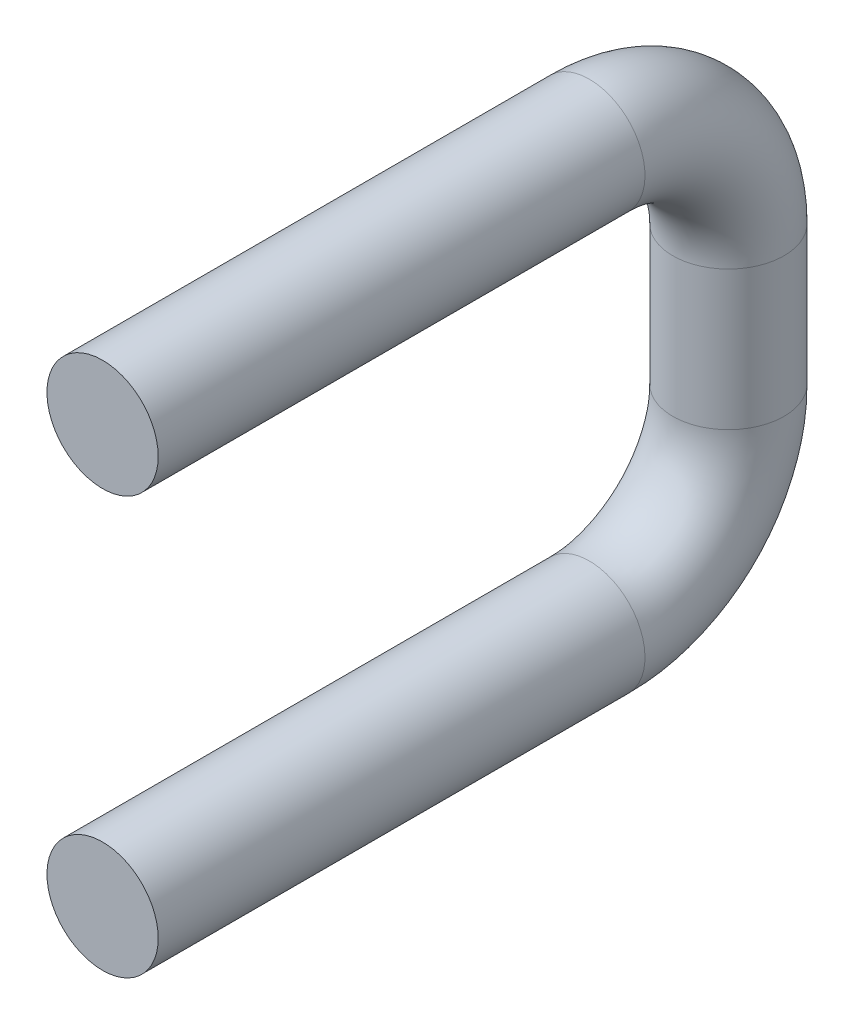
from build123d import *

# Parameters (mm, degrees)
SKETCH_2_R = 4


with BuildPart() as part:
    # По траектории1: sweep along a path in Эскиз1
    with BuildLine(Plane(origin=(0, 0, 0), x_dir=(0, 0, -1), z_dir=(1, 0, 0))) as sweep_1_path:
        Line((0, -15), (35, -15))
        ThreePointArc((35, -15), (42.071067812, -12.071067812), (45, -5))
        Line((45, -5), (45, 5))
        ThreePointArc((45, 5), (42.071067812, 12.071067812), (35, 15))
        Line((35, 15), (0, 15))
    # Эскиз2 → По траектории1 (sweep)
    with BuildSketch(Plane.XY):
        with Locations((0, -15)):
            Circle(SKETCH_2_R)
    sweep(path=sweep_1_path.line)


solid = part.part
